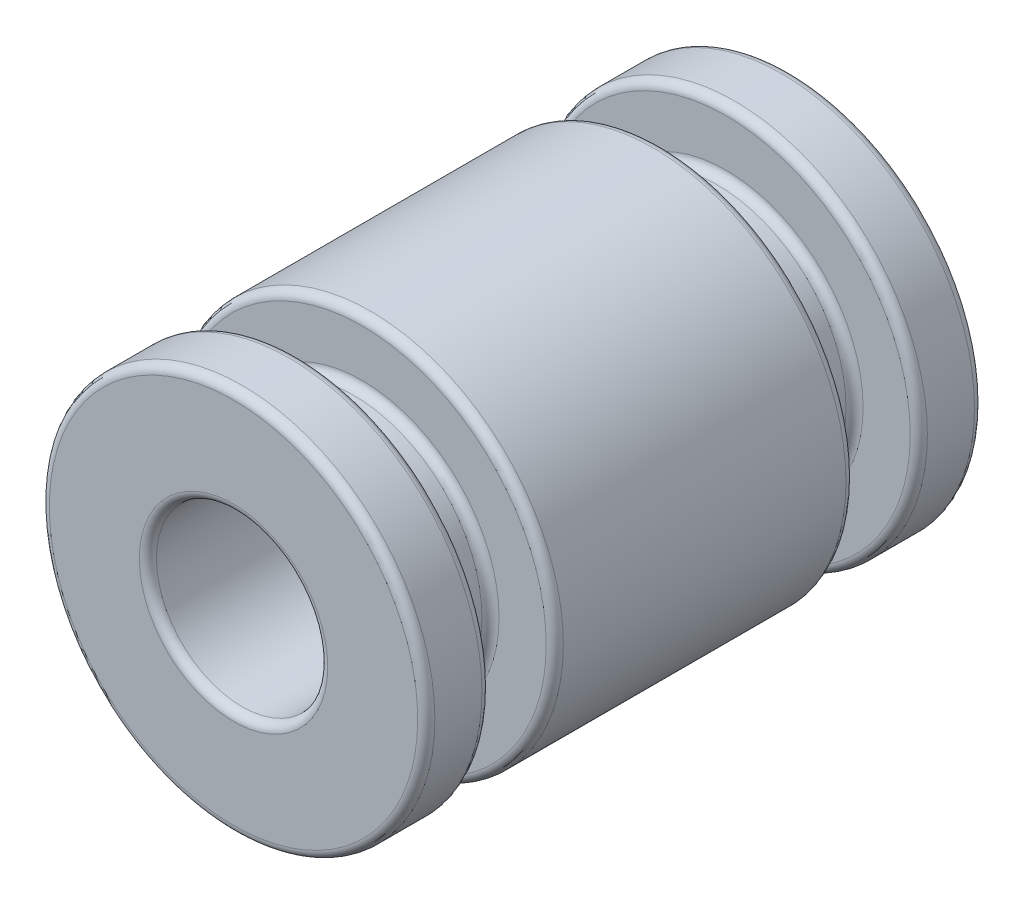
from build123d import *


with BuildPart() as part:
    # Sketch1 → Revolve1 (revolve)
    with BuildSketch(Plane(origin=(0, 0, 0), x_dir=(1, 0, 0), z_dir=(0, 1, 0))):
        with BuildLine():
            Line((2, 6.3), (2, -6.3))
            ThreePointArc((2, -6.3), (2.058578644, -6.441421356), (2.2, -6.5))
            Line((2.2, -6.5), (4.3, -6.5))
            ThreePointArc((4.3, -6.5), (4.441421356, -6.441421356), (4.5, -6.3))
            Line((4.5, -6.3), (4.5, -5.2))
            ThreePointArc((4.5, -5.2), (4.441421356, -5.058578644), (4.3, -5))
            Line((4.3, -5), (3.2, -5))
            ThreePointArc((3.2, -5), (3.058578644, -4.941421356), (3, -4.8))
            Line((3, -4.8), (3, -3.7))
            ThreePointArc((3, -3.7), (3.058578644, -3.558578644), (3.2, -3.5))
            Line((3.2, -3.5), (4.3, -3.5))
            ThreePointArc((4.3, -3.5), (4.441421356, -3.441421356), (4.5, -3.3))
            Line((4.5, -3.3), (4.5, 3.3))
            ThreePointArc((4.5, 3.3), (4.441421356, 3.441421356), (4.3, 3.5))
            Line((4.3, 3.5), (3.2, 3.5))
            ThreePointArc((3.2, 3.5), (3.058578644, 3.558578644), (3, 3.7))
            Line((3, 3.7), (3, 4.8))
            ThreePointArc((3, 4.8), (3.058578644, 4.941421356), (3.2, 5))
            Line((3.2, 5), (4.3, 5))
            ThreePointArc((4.3, 5), (4.441421356, 5.058578644), (4.5, 5.2))
            Line((4.5, 5.2), (4.5, 6.3))
            ThreePointArc((4.5, 6.3), (4.441421356, 6.441421356), (4.3, 6.5))
            Line((4.3, 6.5), (2.2, 6.5))
            ThreePointArc((2.2, 6.5), (2.058578644, 6.441421356), (2, 6.3))
        make_face()
    revolve(axis=Axis((0, 0, -6.503047056), (0, 0, 1)))


solid = part.part
